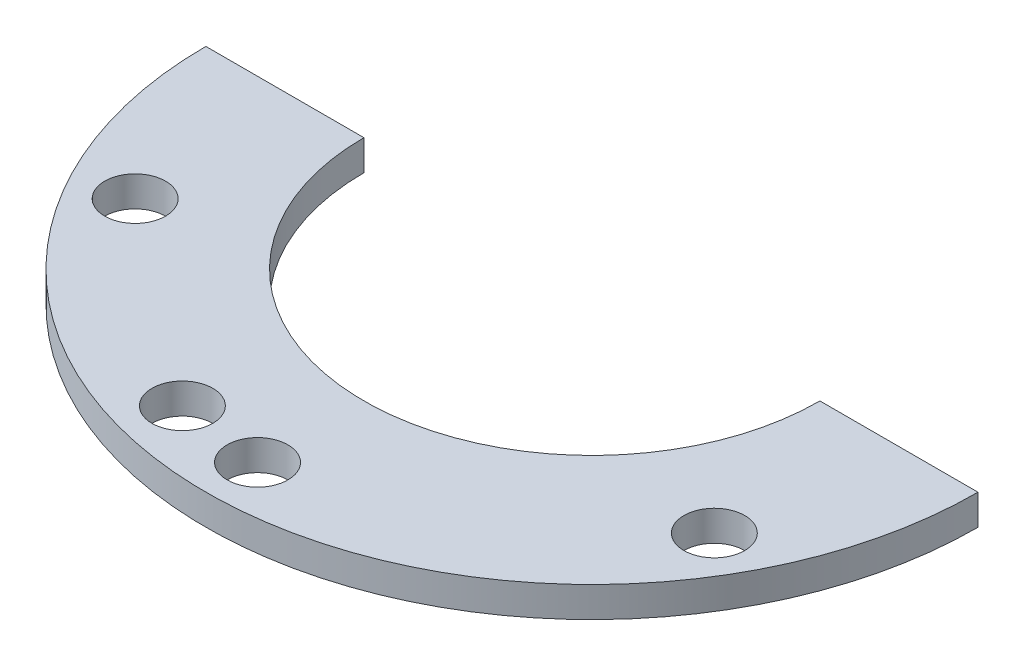
from build123d import *

# Parameters (mm, degrees)
SKETCH1_R               = 12.7
BOSS_EXTRUDE1_DEPTH     = 1
CUT_EXTRUDE1_DEPTH      = 18.98832955
CUT_EXTRUDE1_DEPTH_BACK = 18.98832955
SKETCH19_R              = 1
CUT_EXTRUDE2_DEPTH      = 18.98832955
CUT_EXTRUDE2_DEPTH_BACK = 18.98832955
SKETCH20_R              = 7.5
SKETCH21_W              = 65.874202484
SKETCH21_H              = 51.979273979
CUT_EXTRUDE3_DEPTH      = 18.98832955
CUT_EXTRUDE4_DEPTH      = 18.98832955
CUT_EXTRUDE4_DEPTH_BACK = 18.98832955
SKETCH22_R              = 1


with BuildPart() as part:
    # Sketch1 → Boss-Extrude1 (new body)
    with BuildSketch(Plane(origin=(0, 0, 0), x_dir=(1, 0, 0), z_dir=(0, 1, 0))):
        with Locations(Location((0, 0, 0), (0, 0, 270))):
            Circle(SKETCH1_R)
    extrude(amount=BOSS_EXTRUDE1_DEPTH)

    # Sketch19 → Cut-Extrude1 (cut, two sides: drawn at the far end of the back side and taken through both)
    with BuildSketch(Plane(origin=(0, 1, 0), x_dir=(1, 0, 0), z_dir=(0, 1, 0)).offset(-CUT_EXTRUDE1_DEPTH_BACK)):
        with Locations(Location((0, 11, 0), (0, 0, 270))):
            Circle(SKETCH19_R)
        with Locations(Location((9.526279442, 5.5, 0), (0, 0, 270))):
            Circle(SKETCH19_R)
        with Locations(Location((9.526279442, -5.5, 0), (0, 0, 270))):
            Circle(SKETCH19_R)
        with Locations(Location((0, -11, 0), (0, 0, 270))):
            Circle(SKETCH19_R)
        with Locations(Location((-9.526279442, -5.5, 0), (0, 0, 270))):
            Circle(SKETCH19_R)
        with Locations(Location((-9.526279442, 5.5, 0), (0, 0, 270))):
            Circle(SKETCH19_R)
    extrude(amount=CUT_EXTRUDE1_DEPTH + CUT_EXTRUDE1_DEPTH_BACK, mode=Mode.SUBTRACT)

    # Sketch20 → Cut-Extrude2 (cut, two sides: drawn at the far end of the back side and taken through both)
    with BuildSketch(Plane(origin=(0, 1, 0), x_dir=(1, 0, 0), z_dir=(0, 1, 0)).offset(-CUT_EXTRUDE2_DEPTH_BACK)):
        with Locations(Location((0, 0, 0), (0, 0, 270))):
            Circle(SKETCH20_R)
    extrude(amount=CUT_EXTRUDE2_DEPTH + CUT_EXTRUDE2_DEPTH_BACK, mode=Mode.SUBTRACT)

    # Sketch21 → Cut-Extrude3 (cut, through all)
    with BuildSketch(Plane.XY):
        with Locations((-3.816154381, 6.321647006)):
            Rectangle(SKETCH21_W, SKETCH21_H)
    extrude(amount=-CUT_EXTRUDE3_DEPTH, mode=Mode.SUBTRACT)

    # Sketch22 → Cut-Extrude4 (cut, two sides: drawn at the far end of the back side and taken through both)
    with BuildSketch(Plane(origin=(0, 1, 0), x_dir=(1, 0, 0), z_dir=(0, 1, 0)).offset(-CUT_EXTRUDE4_DEPTH_BACK)):
        with Locations(Location((-2.847009496, -10.625184089, 0), (0, 0, 270))):
            Circle(SKETCH22_R)
    extrude(amount=CUT_EXTRUDE4_DEPTH + CUT_EXTRUDE4_DEPTH_BACK, mode=Mode.SUBTRACT)


solid = part.part
